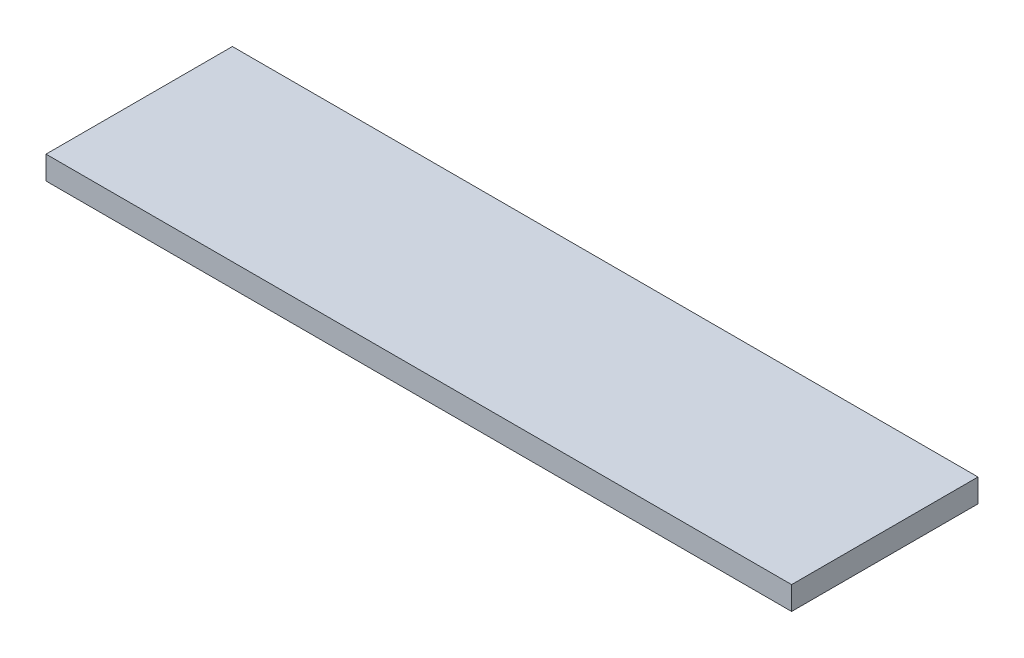
from build123d import *

# Parameters (mm, degrees)
SKETCH1_W           = 101.6
SKETCH1_H           = 25.4
BOSS_EXTRUDE1_DEPTH = 3.175


with BuildPart() as part:
    # Sketch1 → Boss-Extrude1 (new body)
    with BuildSketch(Plane(origin=(0, 0, 0), x_dir=(1, 0, 0), z_dir=(0, 1, 0))):
        with Locations((50.8, 12.7)):
            Rectangle(SKETCH1_W, SKETCH1_H)
    extrude(amount=BOSS_EXTRUDE1_DEPTH)


solid = part.part
